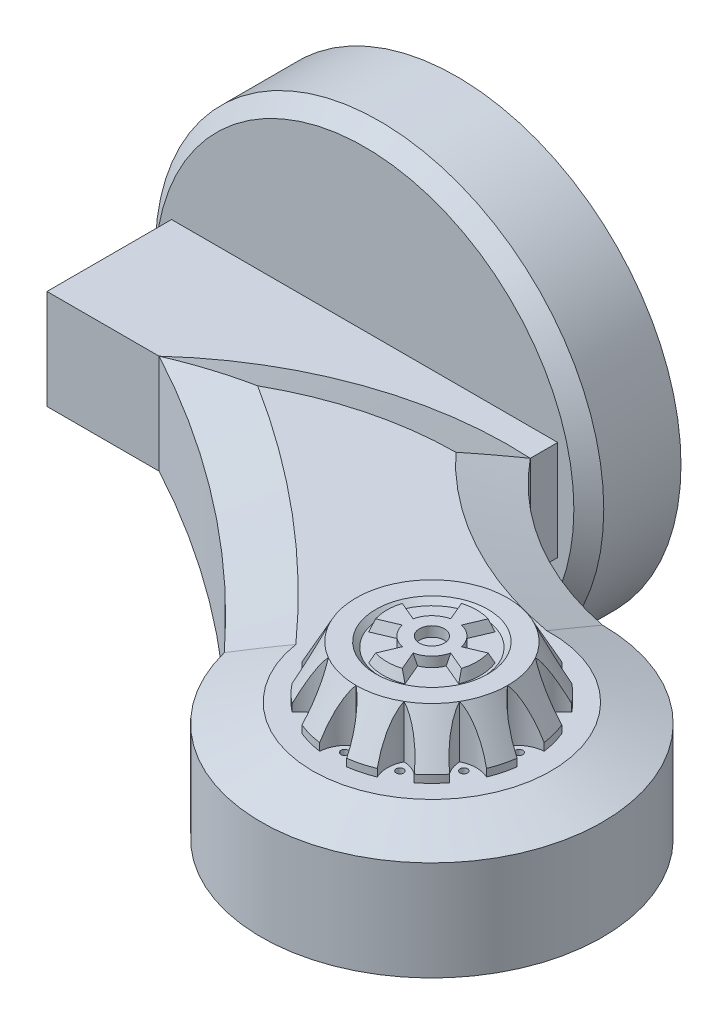
from build123d import *

# Parameters (mm, degrees)
SKETCH1_R                = 90
BOSS_EXTRUDE1_DEPTH      = 37
CHAMFER1_SIZE            = 6
SKETCH2_W                = 155
SKETCH2_H                = 40
BOSS_EXTRUDE2_DEPTH      = 50
CUT_EXTRUDE1_DEPTH       = 167.640331253
BOSS_EXTRUDE3_DEPTH      = 20
BOSS_EXTRUDE4_DEPTH      = 7.5
BOSS_EXTRUDE4_DRAFT      = 70
SKETCH8_R                = 40
BOSS_EXTRUDE5_DEPTH      = 3
SKETCH9_R                = 40
BOSS_EXTRUDE6_DEPTH      = 18
BOSS_EXTRUDE6_TAPER      = 28
CUT_EXTRUDE2_REACH       = 347.162
SKETCH11_R               = 1.5
CUT_EXTRUDE3_DEPTH       = 5
CIRPATTERN1_COUNT        = 12
SKETCH12_R               = 22.5
CUT_EXTRUDE4_DEPTH       = 2
CUT_EXTRUDE4_DRAFT       = -45
BOSS_EXTRUDE7_DEPTH      = 4
BOSS_EXTRUDE7_DRAFT      = 20
CIRPATTERN2_COPY_1_DEPTH = 4
CIRPATTERN2_COPY_1_DRAFT = 20
CIRPATTERN2_COPY_2_DEPTH = 4
CIRPATTERN2_COPY_2_DRAFT = 20
CIRPATTERN2_COPY_3_DEPTH = 4
CIRPATTERN2_COPY_3_DRAFT = 20
SKETCH14_R               = 9.955880937
BOSS_EXTRUDE8_DEPTH      = 4
SKETCH15_R               = 5
CUT_EXTRUDE5_DEPTH       = 4
SKETCH16_R               = 15
CUT_EXTRUDE6_DEPTH       = 20
SKETCH17_R               = 15
CUT_EXTRUDE7_DEPTH       = 20


with BuildPart() as part:
    # Sketch1 → Boss-Extrude1 (new body)
    with BuildSketch(Plane(origin=(0, 0, 0), x_dir=(0, 1, 0), z_dir=(0, 0, 1))):
        with Locations(Location((0, 0, 0), (0, 0, 270))):
            Circle(SKETCH1_R)
    extrude(amount=BOSS_EXTRUDE1_DEPTH)

    # Chamfer1
    chamfer1_edges = [part.edges().sort_by_distance(p)[0] for p in [
        (-90, 0, 37),
    ]]
    chamfer(chamfer1_edges, length=CHAMFER1_SIZE)

    # Sketch2 → Boss-Extrude2 (add)
    with BuildSketch(Plane.XY.offset(37)):
        Rectangle(SKETCH2_W, SKETCH2_H)
    extrude(amount=BOSS_EXTRUDE2_DEPTH)

    # Sketch3 → Cut-Extrude1 (cut, through all)
    with BuildSketch(Plane(origin=(0, 20, 0), x_dir=(-1, 0, 0), z_dir=(0, 1, 0))):
        with BuildLine():
            Line((-77.5, 87), (32.5, 87))
            ThreePointArc((32.5, 87), (-18.551432041, 56.363013449), (-77.5, 48))
            Line((-77.5, 48), (-77.5, 87))
        make_face()
    extrude(amount=-CUT_EXTRUDE1_DEPTH, mode=Mode.SUBTRACT)


with BuildPart() as body_2:
    # Sketch5 → Boss-Extrude3 (new, symmetric)
    with BuildSketch(Plane(origin=(0, 0, 0), x_dir=(-1, 0, 0), z_dir=(0, 1, 0))):
        with BuildLine():
            ThreePointArc((-83.631439907, 176.954770161), (-204.100146747, 202.016950413), (-150, 91.5))
            ThreePointArc((-150, 91.5), (-109.960480223, 76.065866296), (-77.5, 48))
            ThreePointArc((-77.5, 48), (-18.551432041, 56.363013449), (32.5, 87))
            ThreePointArc((32.5, 87), (-29.346212169, 127.096776706), (-83.631439907, 176.954770161))
        make_face()
    extrude(amount=BOSS_EXTRUDE3_DEPTH, both=True)


with BuildPart() as boss_extrude4_tool:
    # Sketch7 → Boss-Extrude4 (with draft: the straight prism first)
    with BuildSketch(Plane(origin=(0, 20, 0), x_dir=(-1, 0, 0), z_dir=(0, 1, 0))):
        with BuildLine():
            ThreePointArc((-83.631439907, 176.954770161), (-204.100146747, 202.016950413), (-150, 91.5))
            ThreePointArc((-150, 91.5), (-109.960480223, 76.065866296), (-77.5, 48))
            ThreePointArc((-77.5, 48), (-18.551432041, 56.363013449), (32.5, 87))
            ThreePointArc((32.5, 87), (-29.346212169, 127.096776706), (-83.631439907, 176.954770161))
        make_face()
    extrude(amount=BOSS_EXTRUDE4_DEPTH)
    # Boss-Extrude4: the draft: its side faces are tilted about the plane it starts from
    boss_extrude4_sides = [boss_extrude4_tool.faces().sort_by_distance(p)[0] for p in [
        (204.100146747, 23.75, 202.016950413),
        (109.960480223, 23.75, 76.065866296),
        (18.551432041, 23.75, 56.363013449),
        (29.346212169, 23.75, 127.096776706),
    ]]
    draft(boss_extrude4_sides, Plane(origin=(0, 20, 0), x_dir=(-1, 0, 0), z_dir=(0, 1, 0)), BOSS_EXTRUDE4_DRAFT)


with BuildPart() as part_1:
    add(part.part)

    # Boss-Extrude4: add boss_extrude4_tool
    add(boss_extrude4_tool.part)

    add(body_2.part)  # Boss-Extrude4 merges body 2

    # Sketch8 → Boss-Extrude5 (add)
    with BuildSketch(Plane(origin=(0, 27.5, 0), x_dir=(-1, 0, 0), z_dir=(0, 1, 0))):
        with Locations(Location((-150, 160, 0), (0, 0, 90))):
            Circle(SKETCH8_R)
    extrude(amount=BOSS_EXTRUDE5_DEPTH)

    # Sketch9 → Boss-Extrude6 (add)
    with BuildSketch(Plane(origin=(0, 30.5, 0), x_dir=(-1, 0, 0), z_dir=(0, 1, 0))):
        with Locations(Location((-150, 160, 0), (0, 0, 90))):
            Circle(SKETCH9_R)
    extrude(amount=BOSS_EXTRUDE6_DEPTH, taper=BOSS_EXTRUDE6_TAPER)

    # Cut-Extrude2: up to this face of the body (flat: up to its plane)
    cut_extrude2_end = Plane(part_1.part.faces().sort_by_distance((96.54683, 27.5, 122.656616853))[0])
    # Sketch10 → Cut-Extrude2 (cut, up to the picked face)
    with BuildSketch(Plane(origin=(0, 48.5, 0), x_dir=(-1, 0, 0), z_dir=(0, 1, 0)), mode=Mode.PRIVATE) as cut_extrude2_sk1:
        with BuildLine():
            ThreePointArc((-144.565185073, 199.629064924), (-150, 200), (-155.434814927, 199.629064924))
            ThreePointArc((-155.434814927, 199.629064924), (-153.797887516, 194.390852508), (-150, 190.42923023))
            ThreePointArc((-150, 190.42923023), (-146.202112484, 194.390852508), (-144.565185073, 199.629064924))
        make_face()
    cut_extrude2_tool1 = split(extrude(cut_extrude2_sk1.sketch, amount=-CUT_EXTRUDE2_REACH, mode=Mode.PRIVATE), bisect_by=cut_extrude2_end, keep=Keep.BOTH, mode=Mode.PRIVATE)
    cut_extrude2 = cut_extrude2_tool1.solids().sort_by(Axis((150, 48.5, 196.227535), (0, -1, 0)))[0]
    add(cut_extrude2, mode=Mode.SUBTRACT)

    # Sketch11 → Cut-Extrude3 (cut)
    with BuildSketch(Plane(origin=(0, 27.5, 0), x_dir=(-1, 0, 0), z_dir=(0, 1, 0))):
        with Locations(Location((-150, 195.029147577, 0), (0, 0, 90))):
            Circle(SKETCH11_R)
    cut_extrude3 = extrude(amount=-CUT_EXTRUDE3_DEPTH, mode=Mode.SUBTRACT)

    # CirPattern1: Cut-Extrude2, Cut-Extrude3 ×12 about axis
    cirpattern1_axis = Axis((150, 0, 160), (0, 1, 0))
    add([cut_extrude2.rotate(cirpattern1_axis, i * 360 / CIRPATTERN1_COUNT) for i in range(1, CIRPATTERN1_COUNT)], mode=Mode.SUBTRACT)
    add([cut_extrude3.rotate(cirpattern1_axis, i * 360 / CIRPATTERN1_COUNT) for i in range(1, CIRPATTERN1_COUNT)], mode=Mode.SUBTRACT)


with BuildPart() as cut_extrude4_tool:
    # Sketch12 → Cut-Extrude4 (with draft: the straight prism first)
    with BuildSketch(Plane(origin=(0, 48.5, 0), x_dir=(-1, 0, 0), z_dir=(0, 1, 0))):
        with Locations((-150, 160)):
            Circle(SKETCH12_R)
    extrude(amount=-CUT_EXTRUDE4_DEPTH)
    # Cut-Extrude4: the draft: its side faces are tilted about the plane it starts from
    cut_extrude4_sides = [cut_extrude4_tool.faces().sort_by_distance(p)[0] for p in [
        (172.5, 47.5, 160),
    ]]
    draft(cut_extrude4_sides, Plane(origin=(0, 48.5, 0), x_dir=(-1, 0, 0), z_dir=(0, 1, 0)), CUT_EXTRUDE4_DRAFT)


with BuildPart() as part_2:
    add(part_1.part)

    # Cut-Extrude4: cut by cut_extrude4_tool
    add(cut_extrude4_tool.part, mode=Mode.SUBTRACT)


with BuildPart() as boss_extrude7_tool:
    # Sketch13 → Boss-Extrude7 (with draft: the straight prism first)
    with BuildSketch(Plane(origin=(0, 46.5, 0), x_dir=(-1, 0, 0), z_dir=(0, 1, 0))):
        with BuildLine():
            ThreePointArc((-153, 167.95298686), (-150, 168.5), (-147, 167.95298686))
            Line((-147, 167.95298686), (-142.700404685, 178.082198656))
            ThreePointArc((-142.700404685, 178.082198656), (-150, 179.5), (-157.299595315, 178.082198656))
            Line((-157.299595315, 178.082198656), (-153, 167.95298686))
        make_face()
    extrude(amount=BOSS_EXTRUDE7_DEPTH)
    # Boss-Extrude7: the draft: its side faces are tilted about the plane it starts from
    boss_extrude7_sides = [boss_extrude7_tool.faces().sort_by_distance(p)[0] for p in [
        (150, 48.5, 168.5),
        (144.850202342, 48.5, 173.017592758),
        (150, 48.5, 179.5),
        (155.149797658, 48.5, 173.017592758),
    ]]
    draft(boss_extrude7_sides, Plane(origin=(0, 46.5, 0), x_dir=(-1, 0, 0), z_dir=(0, 1, 0)), BOSS_EXTRUDE7_DRAFT)


with BuildPart() as part_3:
    add(part_2.part)

    # Boss-Extrude7: add boss_extrude7_tool
    add(boss_extrude7_tool.part)


with BuildPart() as cirpattern2_copy_1_tool:
    # CirPattern2 copy 1 sketch → CirPattern2 copy 1 (with draft: the straight prism first)
    with BuildSketch(Plane(origin=(-10, 46.5, 310), x_dir=(0, 0, 1), z_dir=(0, 1, 0))):
        with BuildLine():
            ThreePointArc((-153, 167.95298686), (-150, 168.5), (-147, 167.95298686))
            Line((-147, 167.95298686), (-142.700404685, 178.082198656))
            ThreePointArc((-142.700404685, 178.082198656), (-150, 179.5), (-157.299595315, 178.082198656))
            Line((-157.299595315, 178.082198656), (-153, 167.95298686))
        make_face()
    extrude(amount=CIRPATTERN2_COPY_1_DEPTH)
    # CirPattern2 copy 1: the draft: its side faces are tilted about the plane it starts from
    cirpattern2_copy_1_sides = [cirpattern2_copy_1_tool.faces().sort_by_distance(p)[0] for p in [
        (158.5, 48.5, 160),
        (163.017592758, 48.5, 165.149797658),
        (169.5, 48.5, 160),
        (163.017592758, 48.5, 154.850202342),
    ]]
    draft(cirpattern2_copy_1_sides, Plane(origin=(-10, 46.5, 310), x_dir=(0, 0, 1), z_dir=(0, 1, 0)), CIRPATTERN2_COPY_1_DRAFT)


with BuildPart() as part_4:
    add(part_3.part)

    # CirPattern2 copy 1: add cirpattern2_copy_1_tool
    add(cirpattern2_copy_1_tool.part)


with BuildPart() as cirpattern2_copy_2_tool:
    # CirPattern2 copy 2 sketch → CirPattern2 copy 2 (with draft: the straight prism first)
    with BuildSketch(Plane(origin=(300, 46.5, 320), x_dir=(1, 0, 0), z_dir=(0, 1, 0))):
        with BuildLine():
            ThreePointArc((-153, 167.95298686), (-150, 168.5), (-147, 167.95298686))
            Line((-147, 167.95298686), (-142.700404685, 178.082198656))
            ThreePointArc((-142.700404685, 178.082198656), (-150, 179.5), (-157.299595315, 178.082198656))
            Line((-157.299595315, 178.082198656), (-153, 167.95298686))
        make_face()
    extrude(amount=CIRPATTERN2_COPY_2_DEPTH)
    # CirPattern2 copy 2: the draft: its side faces are tilted about the plane it starts from
    cirpattern2_copy_2_sides = [cirpattern2_copy_2_tool.faces().sort_by_distance(p)[0] for p in [
        (150, 48.5, 151.5),
        (155.149797658, 48.5, 146.982407242),
        (150, 48.5, 140.5),
        (144.850202342, 48.5, 146.982407242),
    ]]
    draft(cirpattern2_copy_2_sides, Plane(origin=(300, 46.5, 320), x_dir=(1, 0, 0), z_dir=(0, 1, 0)), CIRPATTERN2_COPY_2_DRAFT)


with BuildPart() as part_5:
    add(part_4.part)

    # CirPattern2 copy 2: add cirpattern2_copy_2_tool
    add(cirpattern2_copy_2_tool.part)


with BuildPart() as cirpattern2_copy_3_tool:
    # CirPattern2 copy 3 sketch → CirPattern2 copy 3 (with draft: the straight prism first)
    with BuildSketch(Plane(origin=(310, 46.5, 10), x_dir=(0, 0, -1), z_dir=(0, 1, 0))):
        with BuildLine():
            ThreePointArc((-153, 167.95298686), (-150, 168.5), (-147, 167.95298686))
            Line((-147, 167.95298686), (-142.700404685, 178.082198656))
            ThreePointArc((-142.700404685, 178.082198656), (-150, 179.5), (-157.299595315, 178.082198656))
            Line((-157.299595315, 178.082198656), (-153, 167.95298686))
        make_face()
    extrude(amount=CIRPATTERN2_COPY_3_DEPTH)
    # CirPattern2 copy 3: the draft: its side faces are tilted about the plane it starts from
    cirpattern2_copy_3_sides = [cirpattern2_copy_3_tool.faces().sort_by_distance(p)[0] for p in [
        (141.5, 48.5, 160),
        (136.982407242, 48.5, 154.850202342),
        (130.5, 48.5, 160),
        (136.982407242, 48.5, 165.149797658),
    ]]
    draft(cirpattern2_copy_3_sides, Plane(origin=(310, 46.5, 10), x_dir=(0, 0, -1), z_dir=(0, 1, 0)), CIRPATTERN2_COPY_3_DRAFT)


with BuildPart() as part_6:
    add(part_5.part)

    # CirPattern2 copy 3: add cirpattern2_copy_3_tool
    add(cirpattern2_copy_3_tool.part)

    # Sketch14 → Boss-Extrude8 (add)
    with BuildSketch(Plane(origin=(0, 46.5, 0), x_dir=(-1, 0, 0), z_dir=(0, 1, 0))):
        with Locations((-150, 160)):
            Circle(SKETCH14_R)
    extrude(amount=BOSS_EXTRUDE8_DEPTH)

    # Sketch15 → Cut-Extrude5 (cut)
    with BuildSketch(Plane(origin=(0, 50.5, 0), x_dir=(-1, 0, 0), z_dir=(0, 1, 0))):
        with Locations(Location((-150, 160, 0), (0, 0, 90))):
            Circle(SKETCH15_R)
    extrude(amount=-CUT_EXTRUDE5_DEPTH, mode=Mode.SUBTRACT)

    # Sketch16 → Cut-Extrude6 (cut)
    with BuildSketch(Plane.XZ.offset(20)):
        with Locations((150, 160)):
            Circle(SKETCH16_R)
    extrude(amount=-CUT_EXTRUDE6_DEPTH, mode=Mode.SUBTRACT)

    # Sketch17 → Cut-Extrude7 (cut)
    with BuildSketch(Plane(origin=(0, 0, 0), x_dir=(1, 0, 0), z_dir=(0, 0, -1))):
        with Locations(Location((0, 0, 0), (0, 0, 180))):
            Circle(SKETCH17_R)
    extrude(amount=-CUT_EXTRUDE7_DEPTH, mode=Mode.SUBTRACT)


solid = part_6.part
